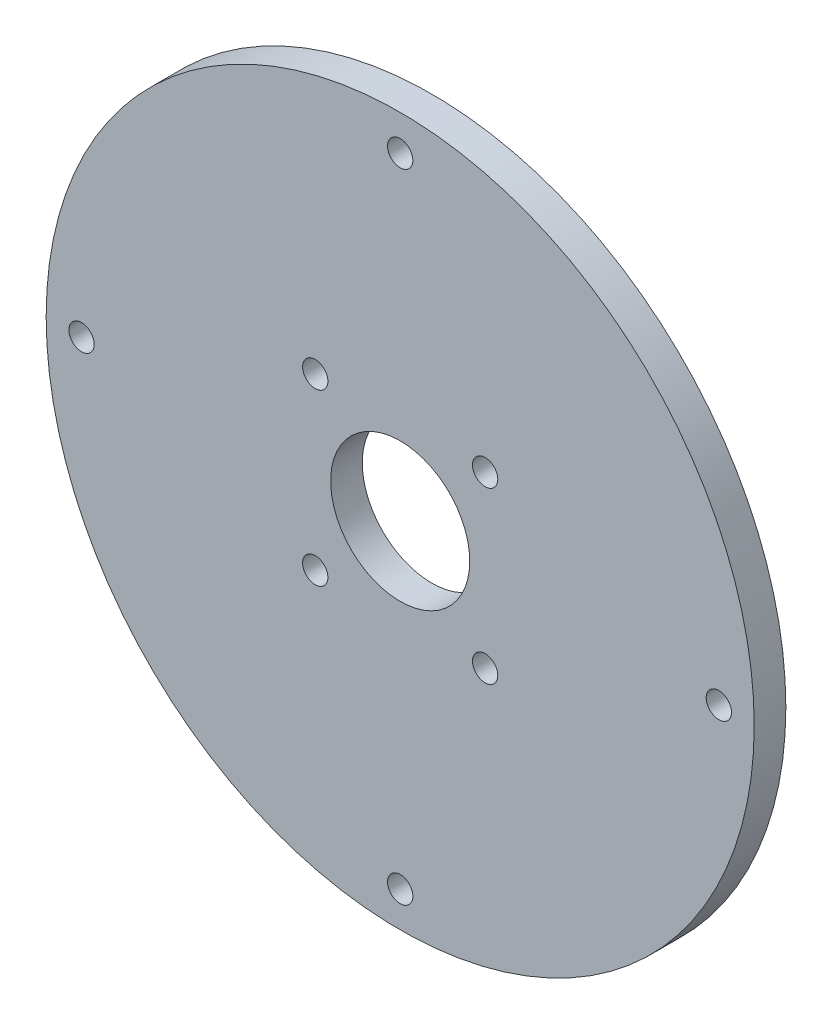
from build123d import *

# Parameters (mm, degrees)
CROQUIS1_W              = 65
CROQUIS1_H              = 65
CROQUIS1_R              = 5.5
CROQUIS1_R_2            = 1
SALIENTE_EXTRUIR1_DEPTH = 2.5
REDONDEO1_R             = 15
CROQUIS5_R              = 47.665857464
CROQUIS5_R_2            = 28
CORTAR_EXTRUIR3_DEPTH   = 2.5
CROQUIS7_R              = 1
CORTAR_EXTRUIR4_DEPTH   = 2.5


with BuildPart() as part:
    # Croquis1 → Saliente-Extruir1 (new body)
    with BuildSketch(Plane.XY):
        Rectangle(CROQUIS1_W, CROQUIS1_H)
        Circle(CROQUIS1_R, mode=Mode.SUBTRACT)
        with Locations((-6.717514421, 6.717514421)):
            Circle(CROQUIS1_R_2, mode=Mode.SUBTRACT)
        with Locations((6.717514421, 6.717514421)):
            Circle(CROQUIS1_R_2, mode=Mode.SUBTRACT)
        with Locations((6.717514421, -6.717514421)):
            Circle(CROQUIS1_R_2, mode=Mode.SUBTRACT)
        with Locations((-6.717514421, -6.717514421)):
            Circle(CROQUIS1_R_2, mode=Mode.SUBTRACT)
    extrude(amount=SALIENTE_EXTRUIR1_DEPTH)

    # Redondeo1
    redondeo1_edges = [part.edges().sort_by_distance(p)[0] for p in [
        (32.5, -32.5, 1.25),
        (-32.5, -32.5, 1.25),
        (-32.5, 32.5, 1.25),
        (32.5, 32.5, 1.25),
    ]]
    fillet(redondeo1_edges, radius=REDONDEO1_R)

    # Croquis5 → Cortar-Extruir3 (cut)
    with BuildSketch(Plane.XY.offset(2.5)):
        Circle(CROQUIS5_R)
        Circle(CROQUIS5_R_2, mode=Mode.SUBTRACT)
    extrude(amount=-CORTAR_EXTRUIR3_DEPTH, mode=Mode.SUBTRACT)

    # Croquis7 → Cortar-Extruir4 (cut)
    with BuildSketch(Plane.XY.offset(2.5)):
        with Locations((0, 25.2)):
            Circle(CROQUIS7_R)
        with Locations((25.2, 0)):
            Circle(CROQUIS7_R)
        with Locations((0, -25.2)):
            Circle(CROQUIS7_R)
        with Locations((-25.2, 0)):
            Circle(CROQUIS7_R)
    extrude(amount=-CORTAR_EXTRUIR4_DEPTH, mode=Mode.SUBTRACT)


solid = part.part
